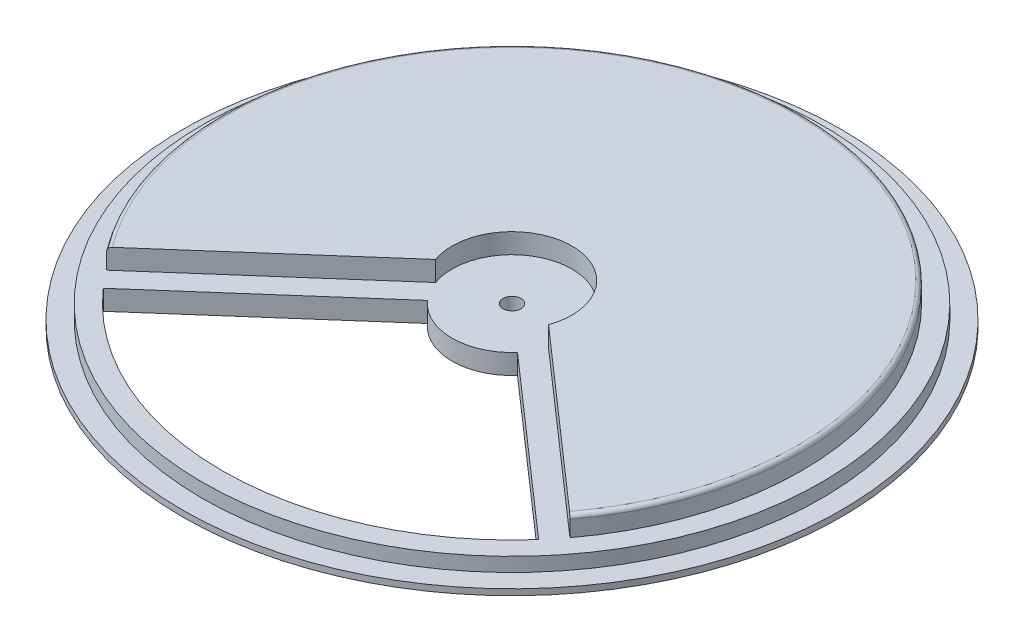
from build123d import *

# Parameters (mm, degrees)
SKETCH1_R           = 209.55
BOSS_EXTRUDE1_DEPTH = 3.81
SKETCH2_R           = 196.85
BOSS_EXTRUDE2_DEPTH = 8.89
SKETCH3_R           = 5.715
CUT_EXTRUDE1_DEPTH  = 297.620456139
BOSS_EXTRUDE3_DEPTH = 12.7
CUT_EXTRUDE2_DEPTH  = 297.620456139
FILLET1_R           = 2.54


with BuildPart() as part:
    # Sketch1 → Boss-Extrude1 (new body)
    with BuildSketch(Plane(origin=(0, 0, 0), x_dir=(1, 0, 0), z_dir=(0, 1, 0))):
        Circle(SKETCH1_R)
    extrude(amount=BOSS_EXTRUDE1_DEPTH)

    # Sketch2 → Boss-Extrude2 (add)
    with BuildSketch(Plane(origin=(0, 3.81, 0), x_dir=(1, 0, 0), z_dir=(0, 1, 0))):
        Circle(SKETCH2_R)
    extrude(amount=BOSS_EXTRUDE2_DEPTH)

    # Sketch3 → Cut-Extrude1 (cut, through all)
    with BuildSketch(Plane(origin=(0, 12.7, 0), x_dir=(1, 0, 0), z_dir=(0, 1, 0))):
        Circle(SKETCH3_R)
    extrude(amount=-CUT_EXTRUDE1_DEPTH, mode=Mode.SUBTRACT)

    # Sketch4 → Boss-Extrude3 (add)
    with BuildSketch(Plane(origin=(0, 12.7, 0), x_dir=(1, 0, 0), z_dir=(0, 1, 0))):
        with BuildLine():
            Line((-147.32, -110.49), (-35.921024484, -12.7))
            ThreePointArc((-35.921024484, -12.7), (0, 38.1), (35.921024484, -12.7))
            Line((35.921024484, -12.7), (147.32, -110.49))
            ThreePointArc((147.32, -110.49), (0, 184.15), (-147.32, -110.49))
        make_face()
    extrude(amount=BOSS_EXTRUDE3_DEPTH)

    # Sketch4<3> → Cut-Extrude2 (cut, through all)
    with BuildSketch(Plane(origin=(0, 12.7, 0), x_dir=(1, 0, 0), z_dir=(0, 1, 0))):
        with BuildLine():
            Line((-147.32, -110.49), (-35.921024484, -12.7))
            ThreePointArc((-35.921024484, -12.7), (0, 38.1), (35.921024484, -12.7))
            Line((35.921024484, -12.7), (147.32, -110.49))
            ThreePointArc((147.32, -110.49), (0, 184.15), (-147.32, -110.49))
        make_face()
        with BuildLine():
            Line((-138.392335529, -121.485735652), (-28.632897006, -25.13497979))
            ThreePointArc((-28.632897006, -25.13497979), (0, -38.1), (28.632897006, -25.13497979))
            Line((28.632897006, -25.13497979), (138.392335529, -121.485735652))
            ThreePointArc((138.392335529, -121.485735652), (0, -184.15), (-138.392335529, -121.485735652))
        make_face()
    extrude(amount=-CUT_EXTRUDE2_DEPTH, mode=Mode.SUBTRACT)


with BuildPart() as cut_extrude2_piece_1:
    # of the separate pieces the step leaves, piece 1, a body of its own (cut_extrude2_pieces)
    add(part.part.solids().sort_by_distance((-147.32, 25.4, 110.49))[0])

    # Fillet1
    fillet1_edges = [cut_extrude2_piece_1.edges().sort_by_distance(p)[0] for p in [
        (0, 25.4, -184.15),
    ]]
    fillet(fillet1_edges, radius=FILLET1_R)


with BuildPart() as cut_extrude2_piece_2:
    # of the separate pieces the step leaves, piece 2, a body of its own (cut_extrude2_pieces)
    add(part.part.solids().sort_by_distance((209.55, 0, 0))[0])


solid = Compound([cut_extrude2_piece_1.part, cut_extrude2_piece_2.part])
